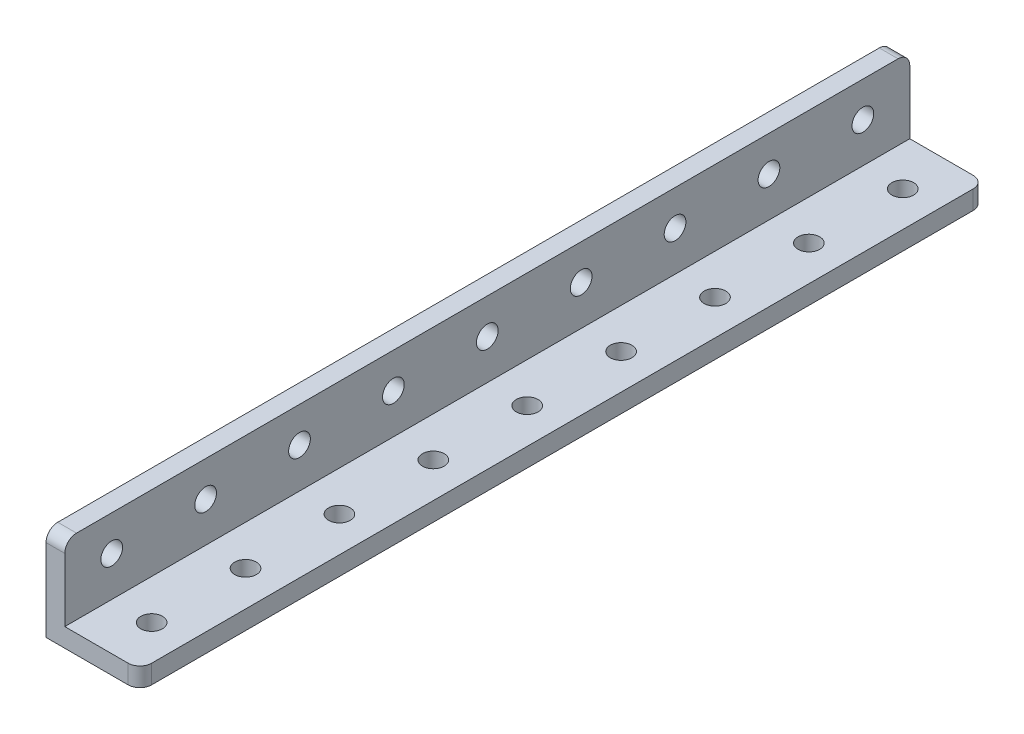
from build123d import *

# Parameters (mm, degrees)
BOSS_EXTRUDE1_DEPTH = 72
SKETCH2_R           = 1.85
CUT_EXTRUDE1_DEPTH  = 76.471849056
CUT_EXTRUDE2_REACH  = 76.859
SKETCH3_R           = 1.85
LPATTERN1_COUNT     = 9
LPATTERN1_PITCH     = 16
FILLET1_R           = 2


with BuildPart() as part:
    # Sketch1 → Boss-Extrude1 (new, symmetric)
    with BuildSketch(Plane.XY):
        Polygon((0, 0), (16, 0), (16, 3.2), (3.2, 3.2), (3.2, 16), (0, 16), align=None)
    extrude(amount=BOSS_EXTRUDE1_DEPTH, both=True)

    # Sketch2 → Cut-Extrude1 (cut, through all)
    with BuildSketch(Plane.ZY):
        with Locations(Location((64, 10, 0), (0, 0, 270))):
            Circle(SKETCH2_R)
    cut_extrude1 = extrude(amount=-CUT_EXTRUDE1_DEPTH, mode=Mode.SUBTRACT)

    # Sketch3 → Cut-Extrude2 (cut, up to next)
    with BuildSketch(Plane(origin=(0, 3.2, 0), x_dir=(1, 0, 0), z_dir=(0, 1, 0)), mode=Mode.PRIVATE) as cut_extrude2_sk1:
        with Locations(Location((10, -64, 0), (0, 0, 180))):
            Circle(SKETCH3_R)
    cut_extrude2_tool1 = extrude(cut_extrude2_sk1.sketch, amount=-CUT_EXTRUDE2_REACH, mode=Mode.PRIVATE) & part.part
    cut_extrude2 = cut_extrude2_tool1.solids().sort_by_distance((10, 3.2, 64))[0]
    add(cut_extrude2, mode=Mode.SUBTRACT)

    # LPattern1: Cut-Extrude1, Cut-Extrude2 ×9
    with Locations(*[(0, 0, -i * LPATTERN1_PITCH) for i in range(1, LPATTERN1_COUNT)]):
        add(cut_extrude1, mode=Mode.SUBTRACT)
        add(cut_extrude2, mode=Mode.SUBTRACT)

    # Fillet1
    fillet1_edges = [part.edges().sort_by_distance(p)[0] for p in [
        (16, 1.6, -72),
        (1.6, 16, -72),
        (1.6, 16, 72),
        (16, 1.6, 72),
    ]]
    fillet(fillet1_edges, radius=FILLET1_R)


solid = part.part
